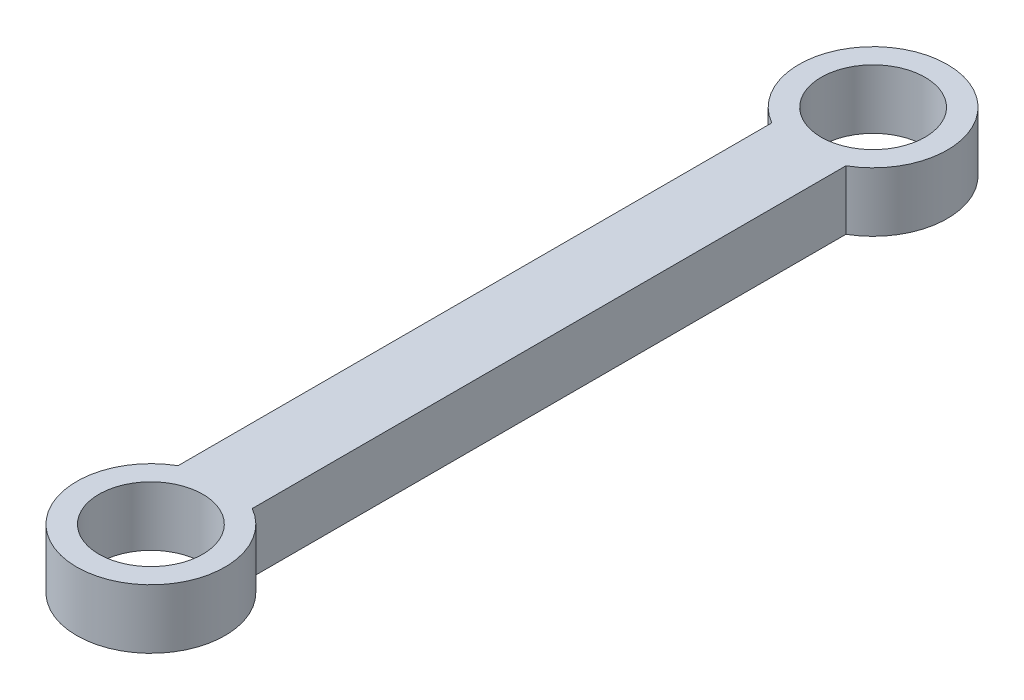
from build123d import *

# Parameters (mm, degrees)
SKETCH1_R           = 1.75
BOSS_EXTRUDE1_DEPTH = 1


with BuildPart() as part:
    # Sketch1 → Boss-Extrude1 (new, symmetric)
    with BuildSketch(Plane(origin=(0, 0, 0), x_dir=(1, 0, 0), z_dir=(0, 1, 0))):
        with BuildLine():
            Line((-1.25, 10), (-1.25, -10))
            ThreePointArc((-1.25, -10), (0, -14.665063509), (1.25, -10))
            Line((1.25, -10), (1.25, 10))
            ThreePointArc((1.25, 10), (0, 14.665063509), (-1.25, 10))
        make_face()
        with Locations(Location((0, 12.165063509, 0), (0, 0, 270))):
            Circle(SKETCH1_R, mode=Mode.SUBTRACT)
        with Locations(Location((0, -12.165063509, 0), (0, 0, 270))):
            Circle(SKETCH1_R, mode=Mode.SUBTRACT)
    extrude(amount=BOSS_EXTRUDE1_DEPTH, both=True)


solid = part.part
